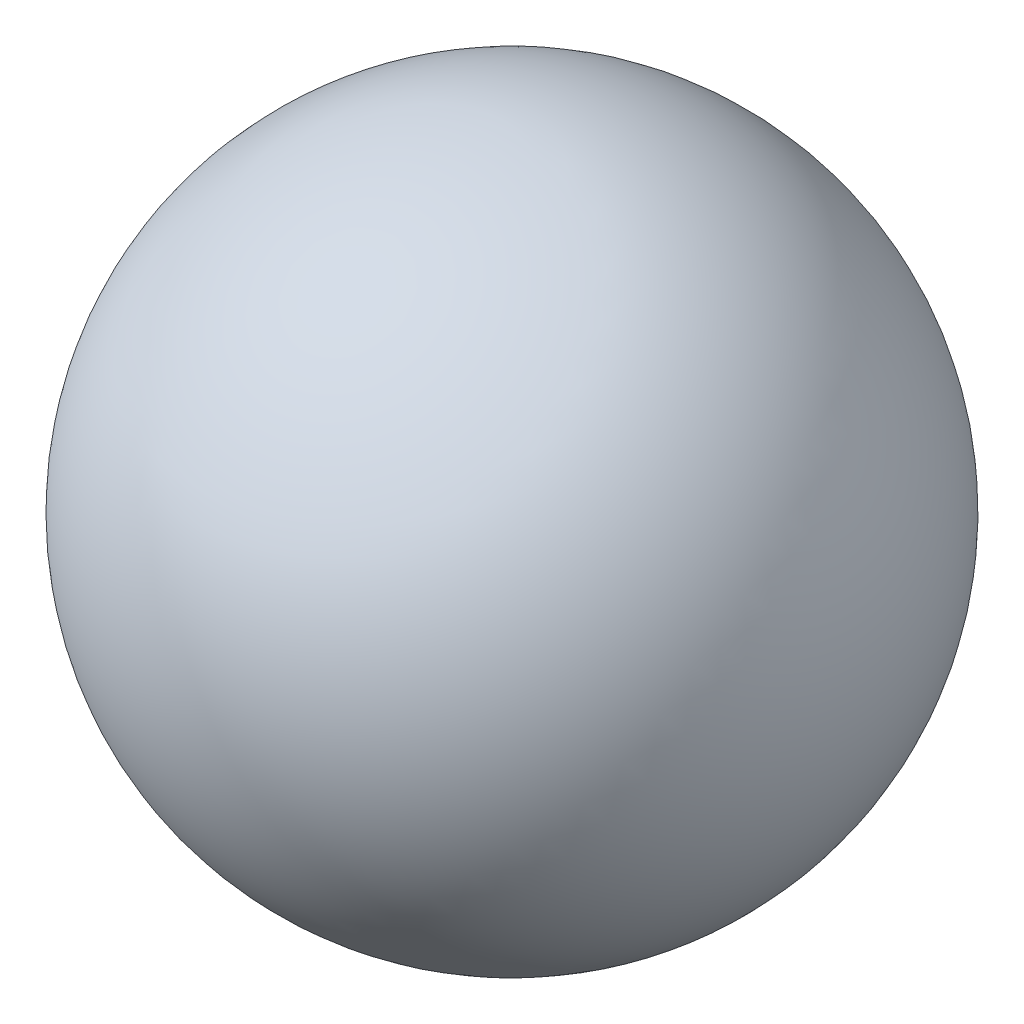
from build123d import *


with BuildPart() as part:
    # Sketch2 → Revolve1 (revolve)
    with BuildSketch(Plane(origin=(-0.886941121, -3.203414239, 11.045056747), x_dir=(0.9944370923979399, 0.04797848572301447, 0.09377064663772991), z_dir=(-0.07689546447381689, -0.27772759666638736, 0.9575773961373923))):
        with BuildLine():
            Line((0, -4.874937186), (0, 4.874937186))
            ThreePointArc((0, 4.874937186), (4.874937186, 0), (0, -4.874937186))
        make_face()
    revolve(axis=Axis((-0.53601482, -7.880726438, 9.716669047), (-0.07198580975780904, 0.959461018988077, 0.2724932957631685)))


solid = part.part
